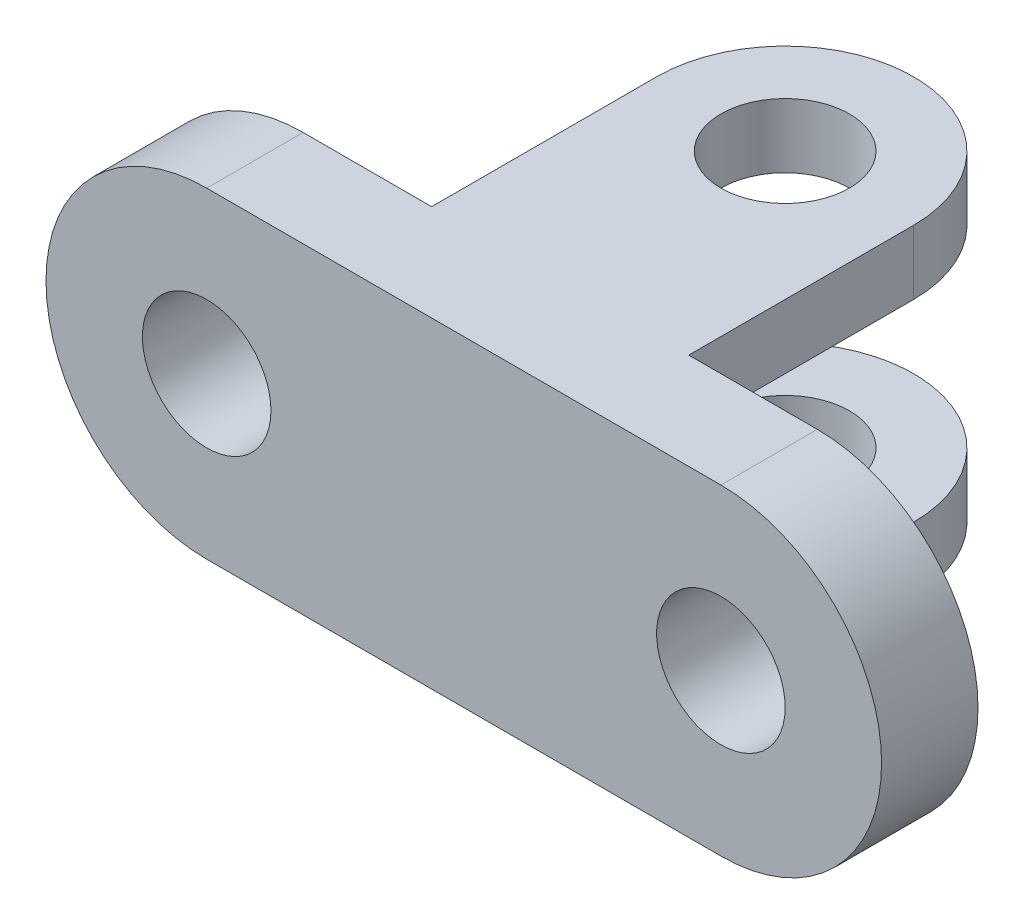
from build123d import *

# Parameters (mm, degrees)
SKETCH7_R                 = 10
BOSS_EXTRUDE2_DEPTH       = 15
BOSS_EXTRUDE3_DEPTH       = 25
BOSS_EXTRUDE3_DEPTH_BACK  = 25
F_2_0MM_DOWEL_HOLE1_D     = 20
F_2_0MM_DOWEL_HOLE1_DEPTH = 100
CUT_EXTRUDE1_DEPTH        = 15
CUT_EXTRUDE1_DEPTH_BACK   = 15


with BuildPart() as part:
    # Sketch7 → Boss-Extrude2 (new body)
    with BuildSketch(Plane.XY):
        with BuildLine():
            Line((-40, 25), (40, 25))
            ThreePointArc((40, 25), (65, 0), (40, -25))
            Line((40, -25), (-40, -25))
            ThreePointArc((-40, -25), (-65, 0), (-40, 25))
        make_face()
        with Locations((-40, 0)):
            Circle(SKETCH7_R, mode=Mode.SUBTRACT)
        with Locations((40, 0)):
            Circle(SKETCH7_R, mode=Mode.SUBTRACT)
    extrude(amount=-BOSS_EXTRUDE2_DEPTH)

    # Sketch8 → Boss-Extrude3 (add, two sides: drawn at the far end of the back side and taken through both)
    with BuildSketch(Plane(origin=(0, 0, 0), x_dir=(1, 0, 0), z_dir=(0, 1, 0)).offset(-BOSS_EXTRUDE3_DEPTH_BACK)):
        with BuildLine():
            Line((-20, 15), (-20, 50))
            ThreePointArc((-20, 50), (0, 70), (20, 50))
            Line((20, 50), (20, 15))
            Line((20, 15), (-20, 15))
        make_face()
    extrude(amount=BOSS_EXTRUDE3_DEPTH + BOSS_EXTRUDE3_DEPTH_BACK)

    # Ø2.0mm Dowel Hole1
    with Locations(Plane.XZ.offset(25)):
        with Locations((0, -50)):
            Hole(F_2_0MM_DOWEL_HOLE1_D / 2, depth=F_2_0MM_DOWEL_HOLE1_DEPTH)

    # Sketch12 → Cut-Extrude1 (cut, two sides: drawn at the far end of the back side and taken through both)
    with BuildSketch(Plane(origin=(0, 0, 0), x_dir=(1, 0, 0), z_dir=(0, 1, 0)).offset(-CUT_EXTRUDE1_DEPTH_BACK)):
        with BuildLine():
            Line((-20, 15), (-20, 50))
            ThreePointArc((-20, 50), (0, 70), (20, 50))
            Line((20, 50), (20, 15))
            Line((20, 15), (-20, 15))
        make_face()
    extrude(amount=CUT_EXTRUDE1_DEPTH + CUT_EXTRUDE1_DEPTH_BACK, mode=Mode.SUBTRACT)


solid = part.part
